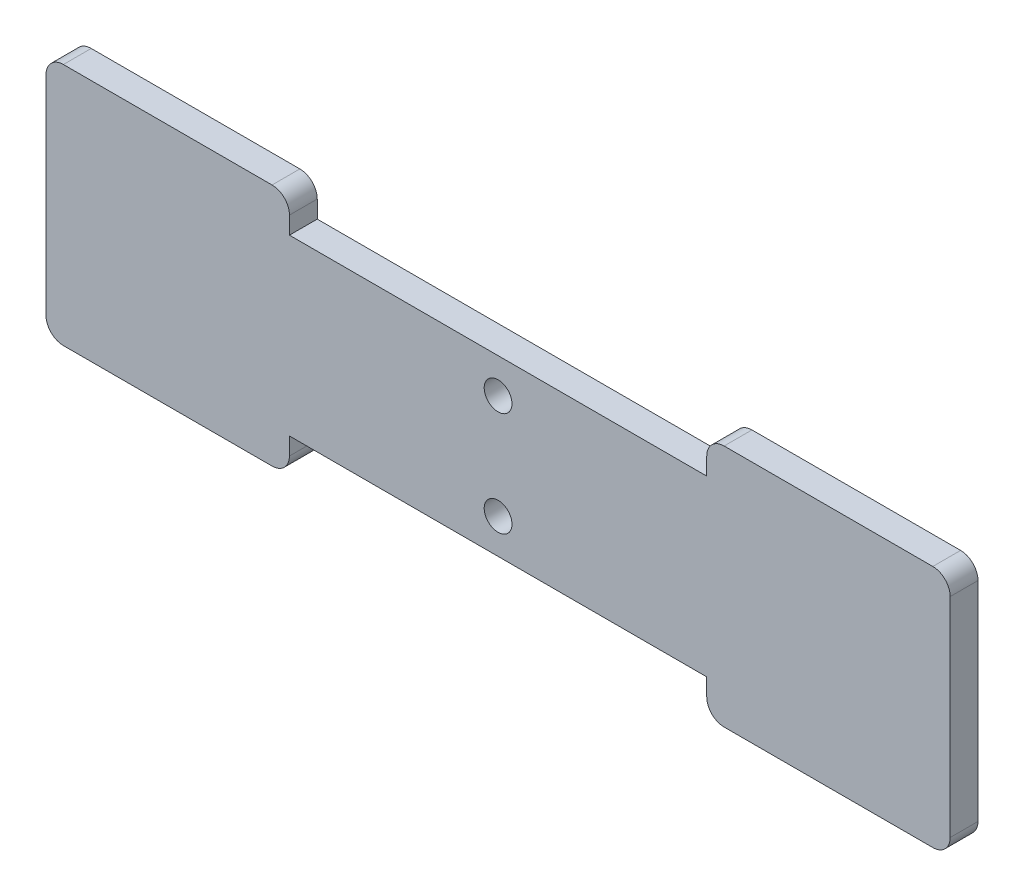
from build123d import *

# Parameters (mm, degrees)
SKETCH_1_W          = 52
SKETCH_1_H          = 10
EXTRUDE_1_DEPTH     = 1.6
SKETCH_2_R          = 0.8
CUT_EXTRUDE_1_DEPTH = 1.6
SKETCH_3_W          = 14
SKETCH_3_H          = 14
EXTRUDE_3_DEPTH     = 1.6
FILLET_1_R          = 1


with BuildPart() as part:
    # 草图1 → 凸台-拉伸1 (new body)
    with BuildSketch(Plane.XY):
        Rectangle(SKETCH_1_W, SKETCH_1_H)
    extrude(amount=EXTRUDE_1_DEPTH)

    # 草图2 → 切除-拉伸1 (cut)
    with BuildSketch(Plane.XY):
        with Locations((0, 3)):
            Circle(SKETCH_2_R)
        with Locations((0, -3)):
            Circle(SKETCH_2_R)
    extrude(amount=CUT_EXTRUDE_1_DEPTH, mode=Mode.SUBTRACT)

    # 草图3 → 凸台-拉伸3 (add)
    with BuildSketch(Plane.XY):
        with Locations((-19, 0)):
            Rectangle(SKETCH_3_W, SKETCH_3_H)
        with Locations((19, 0)):
            Rectangle(SKETCH_3_W, SKETCH_3_H)
    extrude(amount=EXTRUDE_3_DEPTH)

    # 圆角1
    fillet_1_edges = [part.edges().sort_by_distance(p)[0] for p in [
        (-12, -7, 0.8),
        (-26, 7, 0.8),
        (-26, -7, 0.8),
        (-12, 7, 0.8),
        (12, 7, 0.8),
        (12, -7, 0.8),
        (26, -7, 0.8),
        (26, 7, 0.8),
    ]]
    fillet(fillet_1_edges, radius=FILLET_1_R)


solid = part.part
